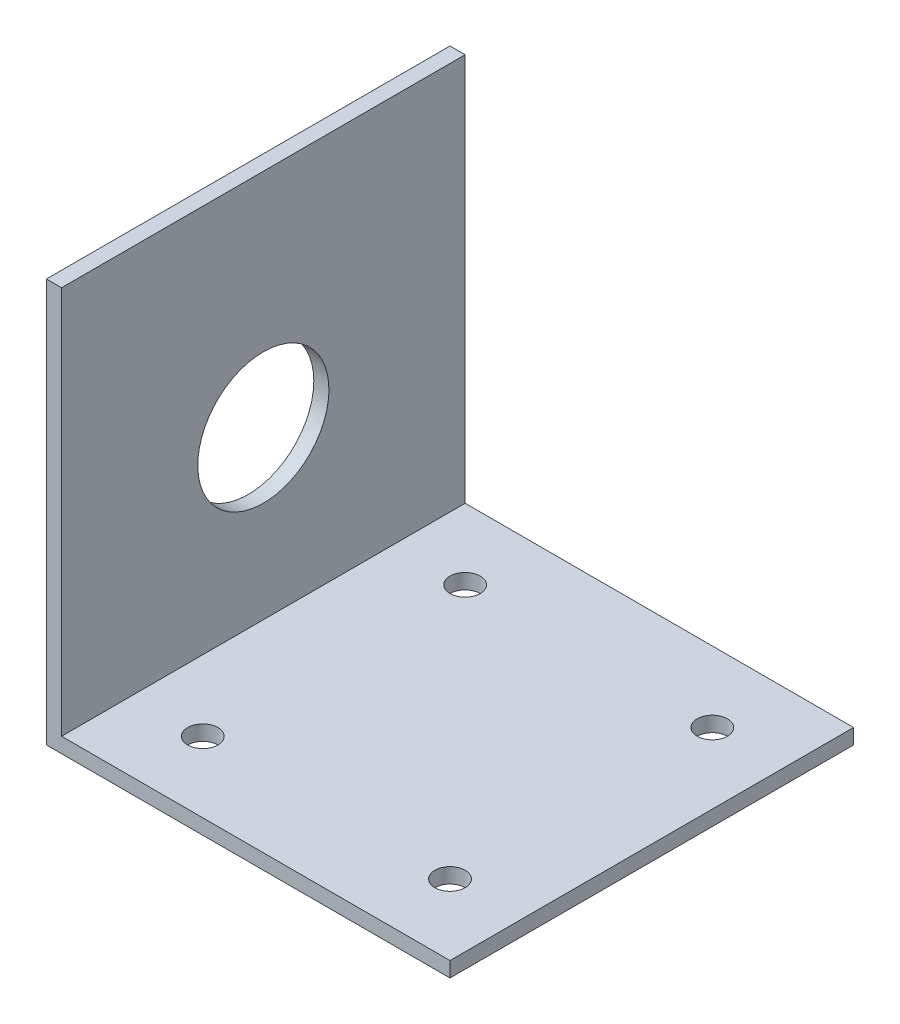
from build123d import *

# Parameters (mm, degrees)
EXTRUSION1_DEPTH = 40
ESQUISSE2_R      = 6.5
EXTRUSION2_DEPTH = 30
ESQUISSE3_R      = 1.5
EXTRUSION3_DEPTH = 30


with BuildPart() as part:
    # Esquisse1 → Extrusion1 (new body)
    with BuildSketch(Plane.XY):
        Polygon((0, 0), (0, 40), (1.5, 40), (1.5, 1.5), (40, 1.5), (40, 0), align=None)
    extrude(amount=EXTRUSION1_DEPTH)

    # Esquisse2 → Extrusion2 (cut)
    with BuildSketch(Plane(origin=(1.5, 0, 0), x_dir=(0, 0, -1), z_dir=(1, 0, 0))):
        with Locations(Location((-20, 18, 0), (0, 0, 90))):
            Circle(ESQUISSE2_R)
    extrude(amount=-EXTRUSION2_DEPTH, mode=Mode.SUBTRACT)

    # Esquisse3 → Extrusion3 (cut)
    with BuildSketch(Plane(origin=(0, 1.5, 0), x_dir=(-1, 0, 0), z_dir=(0, 1, 0))):
        with Locations(Location((-8.5, 33, 0), (0, 0, 90))):
            Circle(ESQUISSE3_R)
        with Locations(Location((-8.5, 7, 0), (0, 0, 90))):
            Circle(ESQUISSE3_R)
        with Locations(Location((-33, 7, 0), (0, 0, 90))):
            Circle(ESQUISSE3_R)
        with Locations(Location((-33, 33, 0), (0, 0, 90))):
            Circle(ESQUISSE3_R)
    extrude(amount=-EXTRUSION3_DEPTH, mode=Mode.SUBTRACT)


solid = part.part
